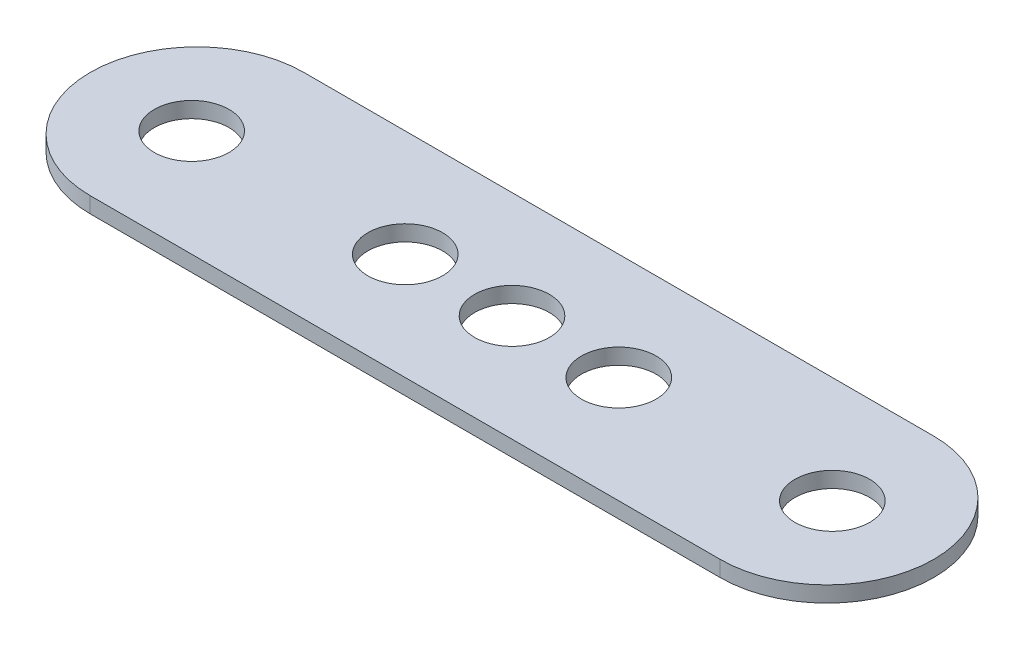
from build123d import *

# Parameters (mm, degrees)
SKETCH1_R                = 2.2225
BAR_DEPTH                = 0.9398
SKETCH2_R                = 2.2225
CENTER_HOLE_DEPTH        = 45.282727435
OTHER_CENTER_HOLES_COUNT = 3
OTHER_CENTER_HOLES_PITCH = 6.35


with BuildPart() as part:
    # Sketch1 → Bar (new body)
    with BuildSketch(Plane(origin=(0, 0, 0), x_dir=(-1, 0, 0), z_dir=(0, 1, 0))):
        with BuildLine():
            Line((37.465, 6.35), (0, 6.35))
            ThreePointArc((0, 6.35), (-6.35, 0), (0, -6.35))
            Line((0, -6.35), (37.465, -6.35))
            ThreePointArc((37.465, -6.35), (43.815, 0), (37.465, 6.35))
        make_face()
        with Locations(Location((37.7825, 0, 0), (0, 0, 90))):
            Circle(SKETCH1_R, mode=Mode.SUBTRACT)
        with Locations(Location((-0.3175, 0, 0), (0, 0, 90))):
            Circle(SKETCH1_R, mode=Mode.SUBTRACT)
    extrude(amount=BAR_DEPTH)

    # Sketch2 → Center Hole (cut, through all)
    with BuildSketch(Plane(origin=(0, 0.9398, 0), x_dir=(1, 0, 0), z_dir=(0, 1, 0))):
        with Locations(Location((-25.0825, 0, 0), (0, 0, 270))):
            Circle(SKETCH2_R)
    center_hole = extrude(amount=-CENTER_HOLE_DEPTH, mode=Mode.SUBTRACT)

    # Other Center Holes: Center Hole ×3
    with Locations(*[(i * OTHER_CENTER_HOLES_PITCH, 0, 0) for i in range(1, OTHER_CENTER_HOLES_COUNT)]):
        add(center_hole, mode=Mode.SUBTRACT)


solid = part.part
